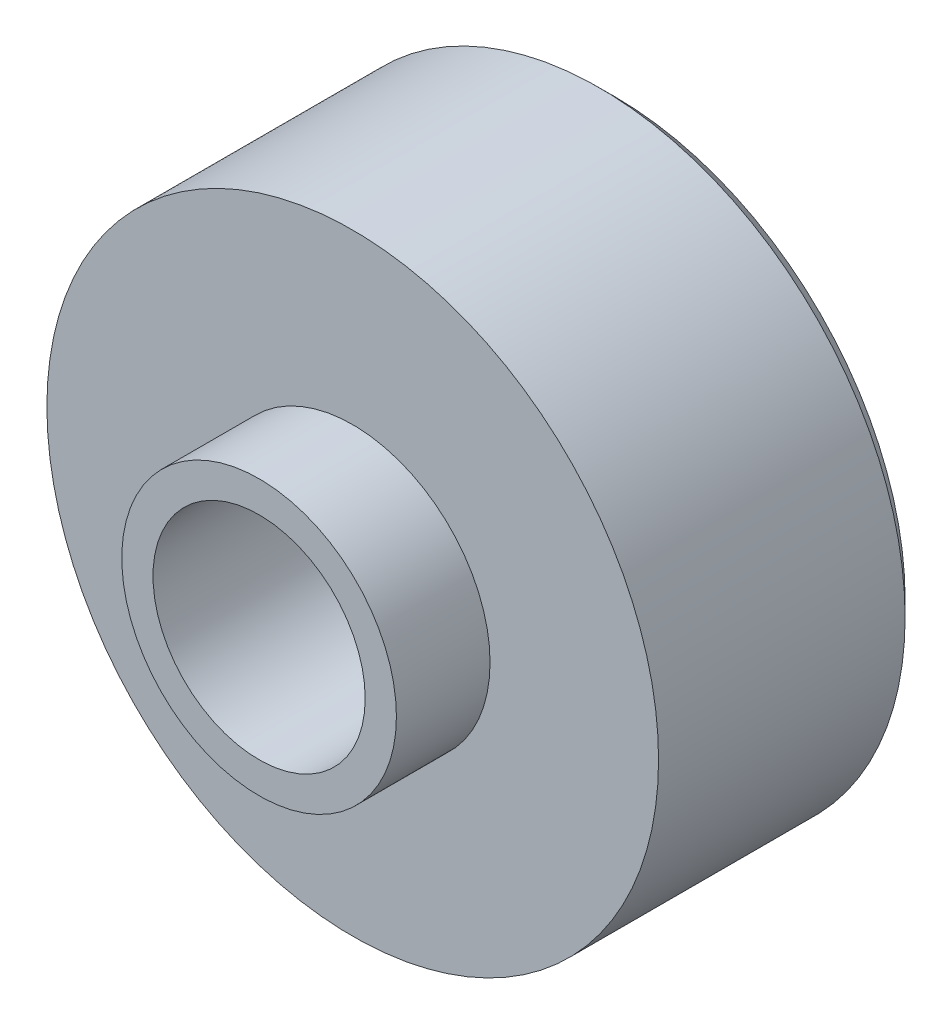
from build123d import *

# Parameters (mm, degrees)
SKETCH1_R           = 4.9
SKETCH1_R_2         = 1.7
BOSS_EXTRUDE1_DEPTH = 4.2
SKETCH2_R           = 2.2
SKETCH2_R_2         = 1.7
BOSS_EXTRUDE2_DEPTH = 1.5
CHAMFER1_SIZE       = 0.25


with BuildPart() as part:
    # Sketch1 → Boss-Extrude1 (new body)
    with BuildSketch(Plane.XY):
        Circle(SKETCH1_R)
        Circle(SKETCH1_R_2, mode=Mode.SUBTRACT)
    extrude(amount=BOSS_EXTRUDE1_DEPTH)

    # Sketch2 → Boss-Extrude2 (add)
    with BuildSketch(Plane.XY.offset(4.2)):
        Circle(SKETCH2_R)
        Circle(SKETCH2_R_2, mode=Mode.SUBTRACT)
    extrude(amount=BOSS_EXTRUDE2_DEPTH)

    # Chamfer1
    chamfer1_edges = [part.edges().sort_by_distance(p)[0] for p in [
        (-4.9, 0, 0),
        (-1.7, 0, 0),
    ]]
    chamfer(chamfer1_edges, length=CHAMFER1_SIZE)


solid = part.part
